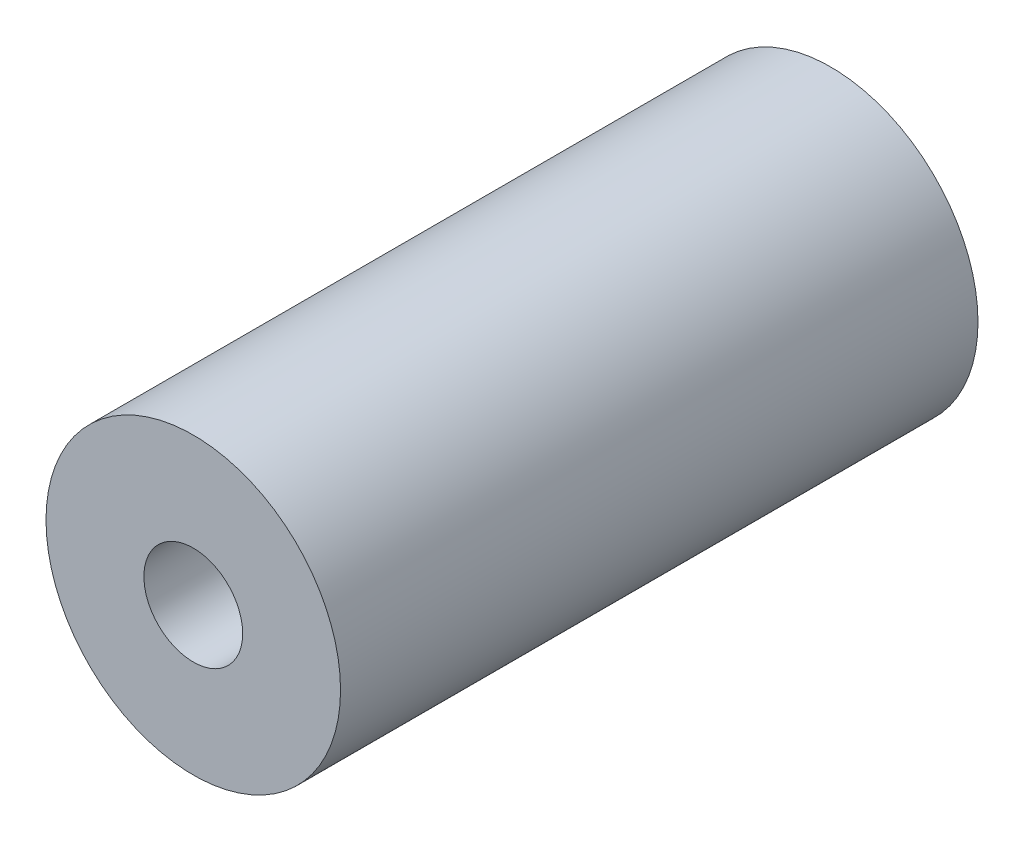
from build123d import *

# Parameters (mm, degrees)
EXTRUDE1_DEPTH       = 36.143
EXTRUDE1_DEPTH_BACK  = 36.143
SKETCH1_R            = 16.7
STROKE_START         = -15.2
SKETCH2_R            = 15.875
STROKE_CHAMBER_DEPTH = 30.4
ROD_HOLE_REACH       = 78.046
SKETCH3_R            = 5.6


with BuildPart() as part:
    # Sketch1 → Extrude1 (new, two sides: drawn at the far end of the back side and taken through both)
    with BuildSketch(Plane.XY.offset(-EXTRUDE1_DEPTH_BACK)):
        Circle(SKETCH1_R)
    extrude(amount=EXTRUDE1_DEPTH + EXTRUDE1_DEPTH_BACK)

    # Sketch2 → STROKE CHAMBER (cut)
    with BuildSketch(Plane.XY.offset(STROKE_START)):
        Circle(SKETCH2_R)
    extrude(amount=STROKE_CHAMBER_DEPTH, mode=Mode.SUBTRACT)

    # Sketch3 → ROD HOLE (cut, up to next)
    with BuildSketch(Plane.XY.offset(36.143), mode=Mode.PRIVATE) as rod_hole_sk1:
        Circle(SKETCH3_R)
    rod_hole_tool1 = extrude(rod_hole_sk1.sketch, amount=-ROD_HOLE_REACH, mode=Mode.PRIVATE) & part.part
    add(rod_hole_tool1.solids().sort_by_distance((0, 0, 36.143))[0], mode=Mode.SUBTRACT)


solid = part.part
